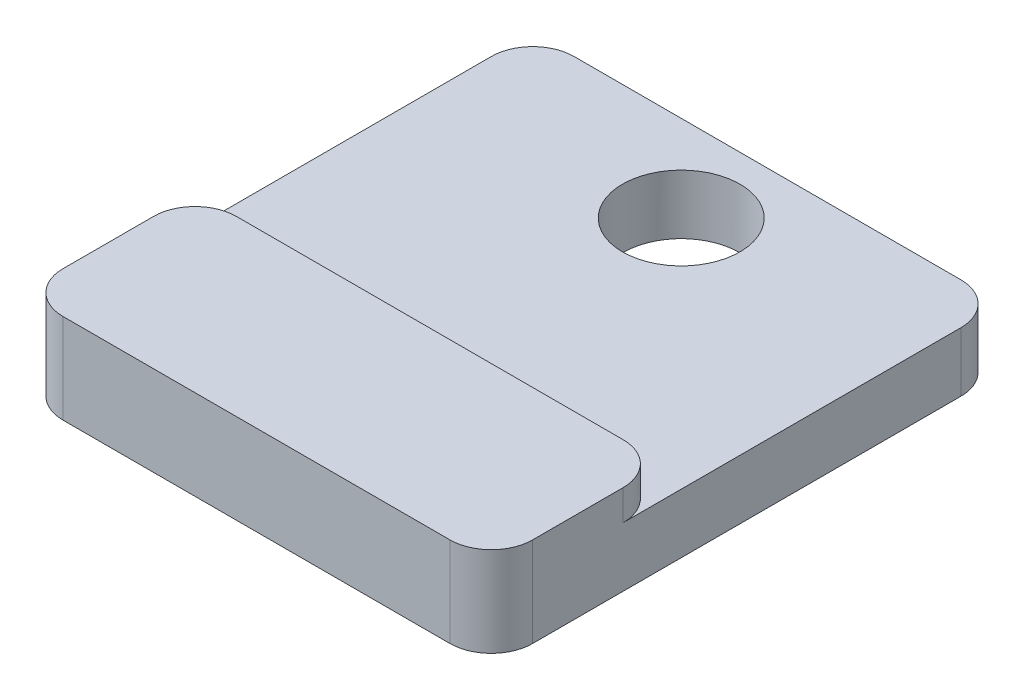
from build123d import *

# Parameters (mm, degrees)
SKETCH1_W           = 215.9
SKETCH1_H           = 234.95
BOSS_EXTRUDE1_DEPTH = 41.275
FILLET1_R           = 19.05
CUT_EXTRUDE1_REACH  = 323.742
SKETCH3_R           = 26.9875
CUT_EXTRUDE2_DEPTH  = 13.97
FILLET2_R           = 19.05


with BuildPart() as part:
    # Sketch1 → Boss-Extrude1 (new body)
    with BuildSketch(Plane(origin=(0, 0, 0), x_dir=(1, 0, 0), z_dir=(0, 1, 0))):
        with Locations((107.95, 117.475)):
            Rectangle(SKETCH1_W, SKETCH1_H)
    extrude(amount=BOSS_EXTRUDE1_DEPTH)

    # Fillet1
    fillet1_edges = [part.edges().sort_by_distance(p)[0] for p in [
        (0, 20.6375, -234.95),
        (215.9, 20.6375, -234.95),
        (215.9, 20.6375, 0),
        (0, 20.6375, 0),
    ]]
    fillet(fillet1_edges, radius=FILLET1_R)

    # Sketch3 → Cut-Extrude1 (cut, up to next)
    with BuildSketch(Plane(origin=(0, 41.275, 0), x_dir=(1, 0, 0), z_dir=(0, 1, 0)), mode=Mode.PRIVATE) as cut_extrude1_sk1:
        with Locations(Location((107.95, 195.2625, 0), (0, 0, 270))):
            Circle(SKETCH3_R)
    cut_extrude1_tool1 = extrude(cut_extrude1_sk1.sketch, amount=-CUT_EXTRUDE1_REACH, mode=Mode.PRIVATE) & part.part
    add(cut_extrude1_tool1.solids().sort_by_distance((107.95, 41.275, -195.2625))[0], mode=Mode.SUBTRACT)

    # Sketch4 → Cut-Extrude2 (cut)
    with BuildSketch(Plane(origin=(0, 41.275, 0), x_dir=(1, 0, 0), z_dir=(0, 1, 0))):
        with BuildLine():
            Line((215.9, 79.6925), (0, 79.6925))
            Line((0, 79.6925), (0, 215.9))
            ThreePointArc((0, 215.9), (5.579615818, 229.370384182), (19.05, 234.95))
            Line((19.05, 234.95), (196.85, 234.95))
            ThreePointArc((196.85, 234.95), (210.320384182, 229.370384182), (215.9, 215.9))
            Line((215.9, 215.9), (215.9, 79.6925))
        make_face()
    extrude(amount=-CUT_EXTRUDE2_DEPTH, mode=Mode.SUBTRACT)

    # Fillet2
    fillet2_edges = [part.edges().sort_by_distance(p)[0] for p in [
        (215.9, 34.29, -79.6925),
        (0, 34.29, -79.6925),
    ]]
    fillet(fillet2_edges, radius=FILLET2_R)


solid = part.part
